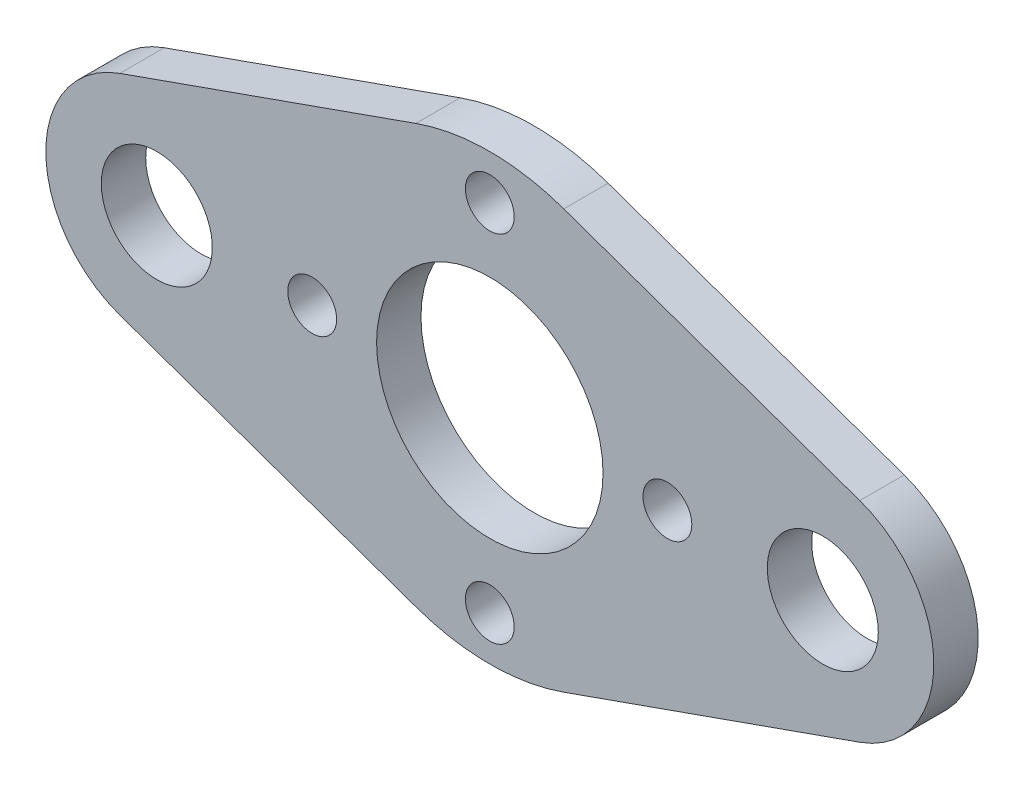
from build123d import *

# Parameters (mm, degrees)
SKETCH_1_R      = 1.1
SKETCH_1_R_2    = 5.1
SKETCH_1_R_3    = 2.5
EXTRUDE_1_DEPTH = 2


with BuildPart() as part:
    # 草图1 → 凸台-拉伸1 (new body)
    with BuildSketch(Plane.XY):
        with BuildLine():
            Line((3.333333333, 9.428090416), (16.666666667, 4.714045208))
            ThreePointArc((16.666666667, 4.714045208), (20, 0), (16.666666667, -4.714045208))
            Line((16.666666667, -4.714045208), (3.333333333, -9.428090416))
            ThreePointArc((3.333333333, -9.428090416), (0, -10), (-3.333333333, -9.428090416))
            Line((-3.333333333, -9.428090416), (-16.666666667, -4.714045208))
            ThreePointArc((-16.666666667, -4.714045208), (-20, 0), (-16.666666667, 4.714045208))
            Line((-16.666666667, 4.714045208), (-3.333333333, 9.428090416))
            ThreePointArc((-3.333333333, 9.428090416), (0, 10), (3.333333333, 9.428090416))
        make_face()
        with Locations((0, 8)):
            Circle(SKETCH_1_R, mode=Mode.SUBTRACT)
        with Locations((8, 0)):
            Circle(SKETCH_1_R, mode=Mode.SUBTRACT)
        with Locations((0, -8)):
            Circle(SKETCH_1_R, mode=Mode.SUBTRACT)
        with Locations((-8, 0)):
            Circle(SKETCH_1_R, mode=Mode.SUBTRACT)
        Circle(SKETCH_1_R_2, mode=Mode.SUBTRACT)
        with Locations((15, 0)):
            Circle(SKETCH_1_R_3, mode=Mode.SUBTRACT)
        with Locations(Location((-15, 0, 0), (0, 0, 180))):
            Circle(SKETCH_1_R_3, mode=Mode.SUBTRACT)
    extrude(amount=EXTRUDE_1_DEPTH)


solid = part.part
